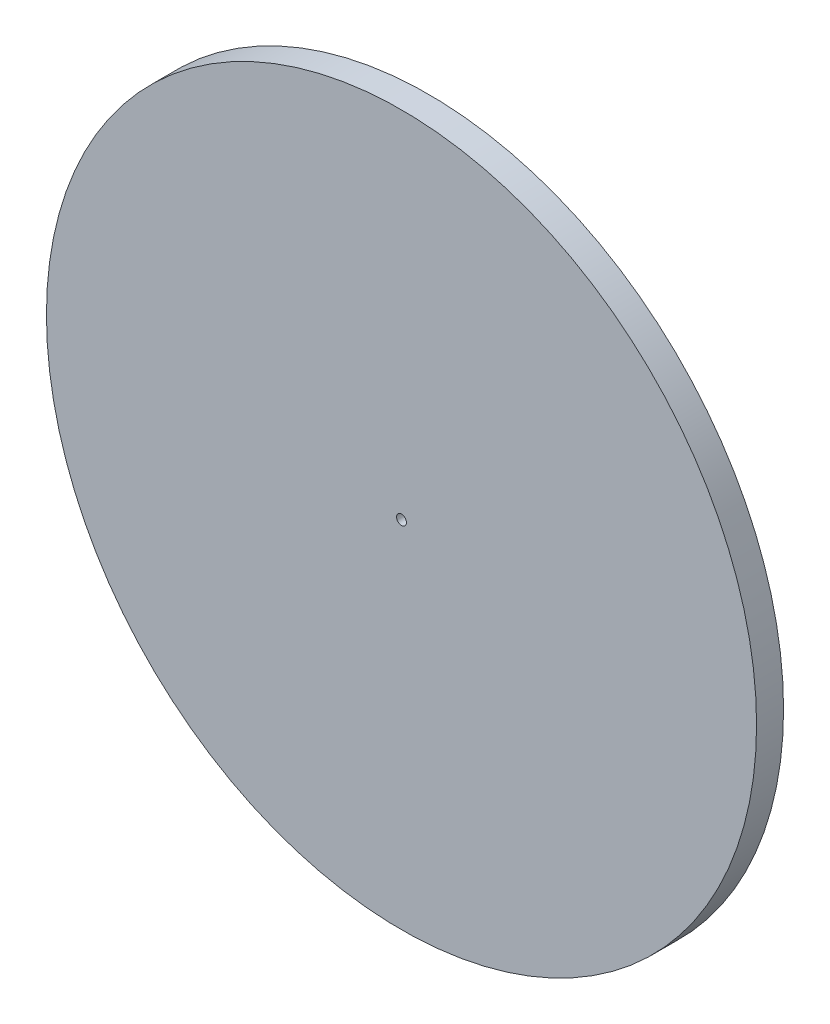
from build123d import *

# Parameters (mm, degrees)
SKETCH2_R           = 250
SKETCH2_R_2         = 3.5
BOSS_EXTRUDE1_DEPTH = 9.5
SKETCH3_R           = 31
CUT_EXTRUDE1_DEPTH  = 9


with BuildPart() as part:
    # Sketch2 → Boss-Extrude1 (new, symmetric)
    with BuildSketch(Plane.XY):
        Circle(SKETCH2_R)
        Circle(SKETCH2_R_2, mode=Mode.SUBTRACT)
    extrude(amount=BOSS_EXTRUDE1_DEPTH, both=True)

    # Sketch3 → Cut-Extrude1 (cut)
    with BuildSketch(Plane(origin=(0, 0, -9.5), x_dir=(-1, 0, 0), z_dir=(0, 0, -1))):
        Circle(SKETCH3_R)
    extrude(amount=-CUT_EXTRUDE1_DEPTH, mode=Mode.SUBTRACT)


solid = part.part
